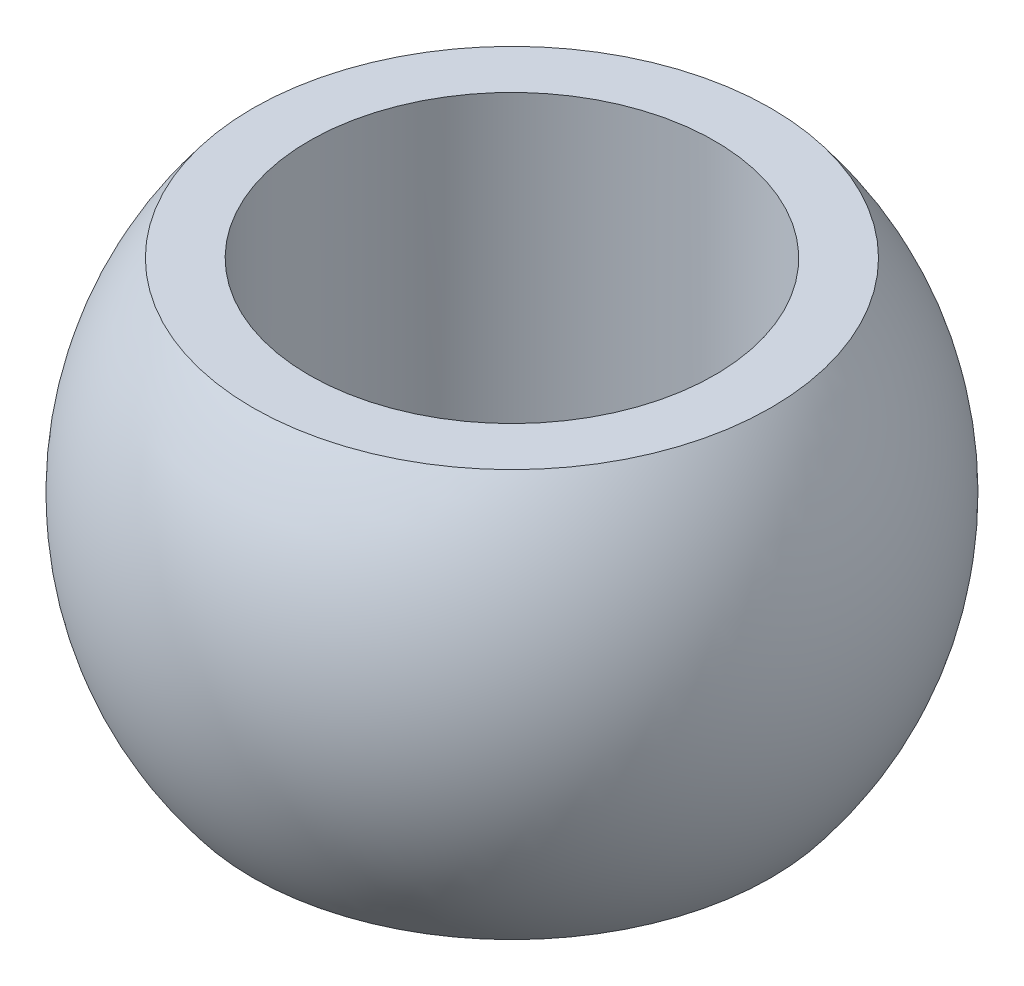
from build123d import *

# Parameters (mm, degrees)
SKETCH2_R           = 4
CUT_EXTRUDE1_DEPTH  = 9.5
SKETCH3_OUTSIDE_W   = 19.21
SKETCH3_OUTSIDE_H   = 16.456
SKETCH3_OUTSIDE_W_2 = 16.89881261
SKETCH3_OUTSIDE_H_2 = 8.027852412
CUT_EXTRUDE2_DEPTH  = 9.5


with BuildPart() as part:
    # Sketch1 → Revolve4 (revolve)
    with BuildSketch(Plane.XY):
        with BuildLine():
            Line((0, 6.5), (0, -6.5))
            ThreePointArc((0, -6.5), (6.5, 0), (0, 6.5))
        make_face()
    revolve(axis=Axis((0, 0, 0), (0, 1, 0)))

    # Sketch2 → Cut-Extrude1 (cut, symmetric)
    with BuildSketch(Plane(origin=(0, 0, 0), x_dir=(1, 0, 0), z_dir=(0, 1, 0))):
        with Locations(Location((0, 0, 0), (0, 0, 180))):
            Circle(SKETCH2_R)
    extrude(amount=CUT_EXTRUDE1_DEPTH, both=True, mode=Mode.SUBTRACT)

    # Sketch3 outside → Cut-Extrude2 (cut, symmetric)
    with BuildSketch(Plane.XY):
        Rectangle(SKETCH3_OUTSIDE_W, SKETCH3_OUTSIDE_H)
        Rectangle(SKETCH3_OUTSIDE_W_2, SKETCH3_OUTSIDE_H_2, mode=Mode.SUBTRACT)
    extrude(amount=CUT_EXTRUDE2_DEPTH, both=True, mode=Mode.SUBTRACT)


solid = part.part
